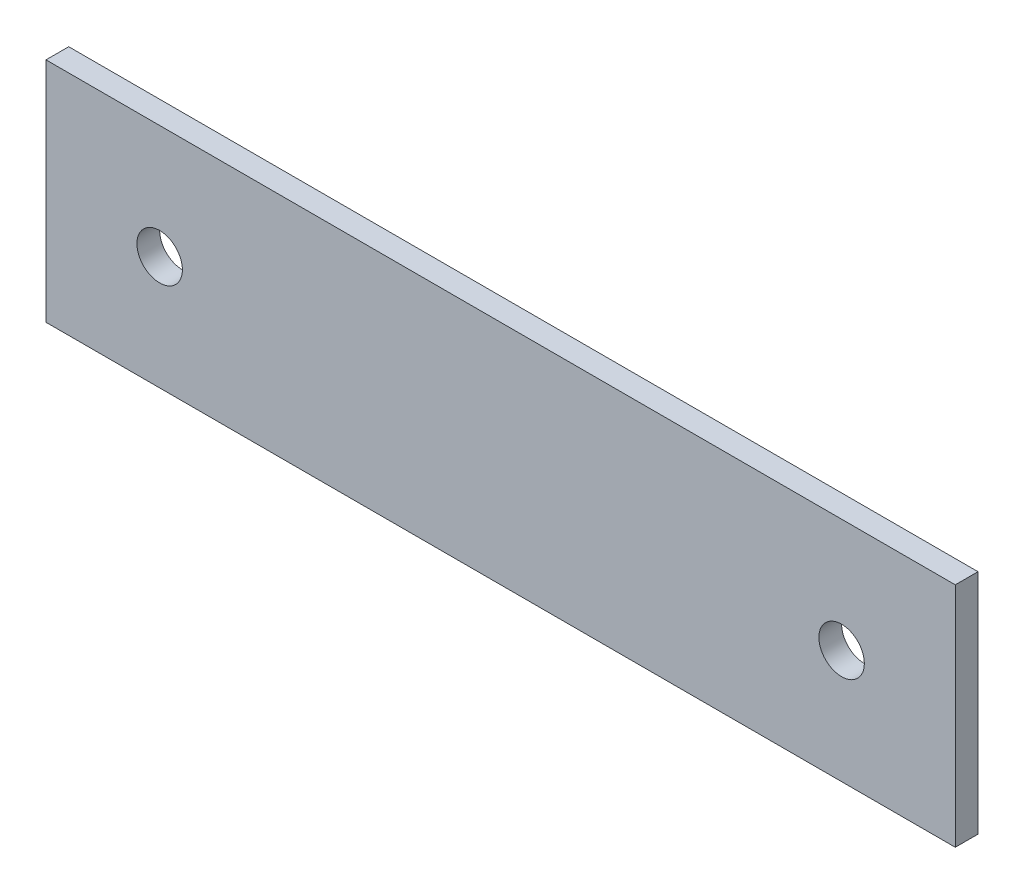
from build123d import *

# Parameters (mm, degrees)
SKETCH1_W           = 80
SKETCH1_H           = 20
BOSS_EXTRUDE1_DEPTH = 2
SKETCH3_R           = 2
CUT_EXTRUDE1_DEPTH  = 2


with BuildPart() as part:
    # Sketch1 → Boss-Extrude1 (new body)
    with BuildSketch(Plane.XY):
        Rectangle(SKETCH1_W, SKETCH1_H)
    extrude(amount=BOSS_EXTRUDE1_DEPTH)

    # Sketch3 → Cut-Extrude1 (cut)
    with BuildSketch(Plane.XY.offset(2)):
        with Locations((-30, 0)):
            Circle(SKETCH3_R)
        with Locations((30, 0)):
            Circle(SKETCH3_R)
    extrude(amount=-CUT_EXTRUDE1_DEPTH, mode=Mode.SUBTRACT)


solid = part.part
